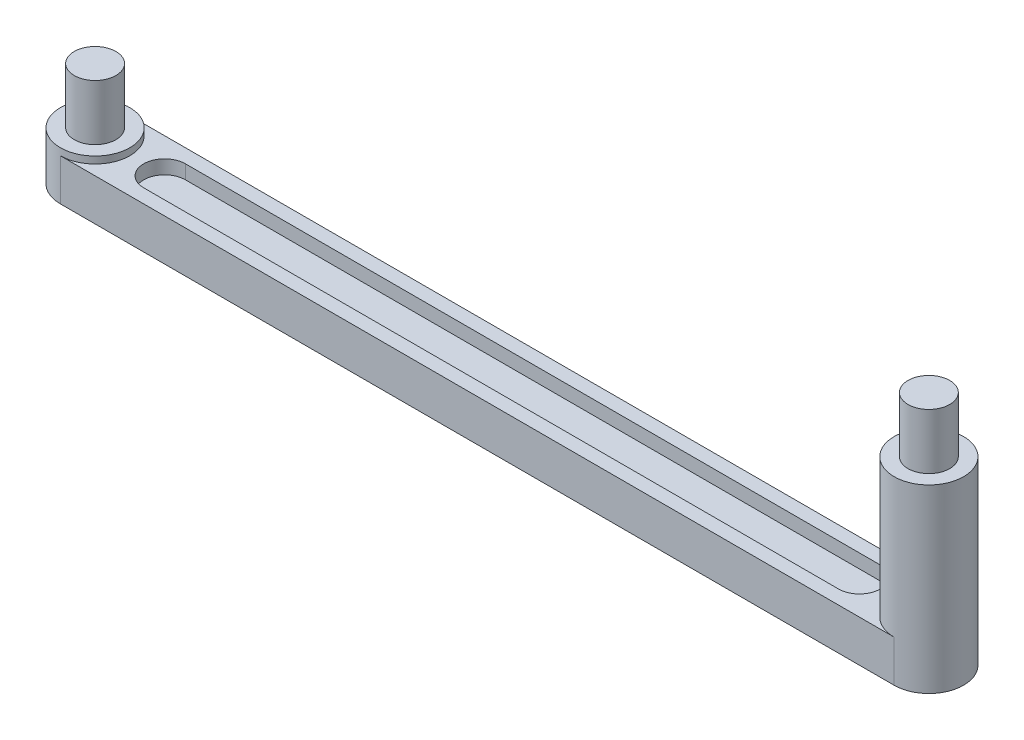
from build123d import *

# Parameters (mm, degrees)
EXTRUDE_1_DEPTH     = 3
EXTRUDE_2_DEPTH     = 0.5
SKETCH_3_R          = 1.5
EXTRUDE_3_DEPTH     = 4.5
EXTRUDE_4_DEPTH     = 10
SKETCH_3_3_R        = 1.5
EXTRUDE_5_DEPTH     = 14
CUT_EXTRUDE_1_DEPTH = 1


with BuildPart() as part:
    # Эскиз1 → Бобышка-Вытянуть1 (new body)
    with BuildSketch(Plane(origin=(0, 0, 0), x_dir=(1, 0, 0), z_dir=(0, 1, 0))):
        with BuildLine():
            Line((30, -2.5), (-30, -2.5))
            ThreePointArc((-30, -2.5), (-32.5, 0), (-30, 2.5))
            Line((-30, 2.5), (30, 2.5))
            ThreePointArc((30, 2.5), (32.5, 0), (30, -2.5))
        make_face()
    extrude(amount=EXTRUDE_1_DEPTH)

    # Эскиз2 → Бобышка-Вытянуть2 (add)
    with BuildSketch(Plane(origin=(0, 3, 0), x_dir=(1, 0, 0), z_dir=(0, 1, 0))):
        with BuildLine():
            ThreePointArc((-30, -2.5), (-28.232233047, -1.767766953), (-27.5, 0))
            ThreePointArc((-27.5, 0), (-28.232233047, 1.767766953), (-30, 2.5))
            ThreePointArc((-30, 2.5), (-32.5, 0), (-30, -2.5))
        make_face()
    extrude(amount=EXTRUDE_2_DEPTH)

    # Эскиз3 → Бобышка-Вытянуть3 (add)
    with BuildSketch(Plane(origin=(0, 3, 0), x_dir=(1, 0, 0), z_dir=(0, 1, 0))):
        with Locations(Location((-30, 0, 0), (0, 0, 270))):
            Circle(SKETCH_3_R)
    extrude(amount=EXTRUDE_3_DEPTH)

    # Эскиз2<3> → Бобышка-Вытянуть4 (add)
    with BuildSketch(Plane(origin=(0, 3, 0), x_dir=(1, 0, 0), z_dir=(0, 1, 0))):
        with BuildLine():
            ThreePointArc((30, -2.5), (31.767766953, -1.767766953), (32.5, 0))
            ThreePointArc((32.5, 0), (31.767766953, 1.767766953), (30, 2.5))
            ThreePointArc((30, 2.5), (27.5, 0), (30, -2.5))
        make_face()
    extrude(amount=EXTRUDE_4_DEPTH)

    # Эскиз3<3> → Бобышка-Вытянуть5 (add)
    with BuildSketch(Plane(origin=(0, 3, 0), x_dir=(1, 0, 0), z_dir=(0, 1, 0))):
        with Locations(Location((30, 0, 0), (0, 0, 270))):
            Circle(SKETCH_3_3_R)
    extrude(amount=EXTRUDE_5_DEPTH)

    # Эскиз4 → Вырез-Вытянуть1 (cut)
    with BuildSketch(Plane(origin=(0, 3, 0), x_dir=(1, 0, 0), z_dir=(0, 1, 0))):
        with BuildLine():
            Line((25, -1.5), (-25, -1.5))
            ThreePointArc((-25, -1.5), (-26.5, 0), (-25, 1.5))
            Line((-25, 1.5), (25, 1.5))
            ThreePointArc((25, 1.5), (26.5, 0), (25, -1.5))
        make_face()
    extrude(amount=-CUT_EXTRUDE_1_DEPTH, mode=Mode.SUBTRACT)


solid = part.part
